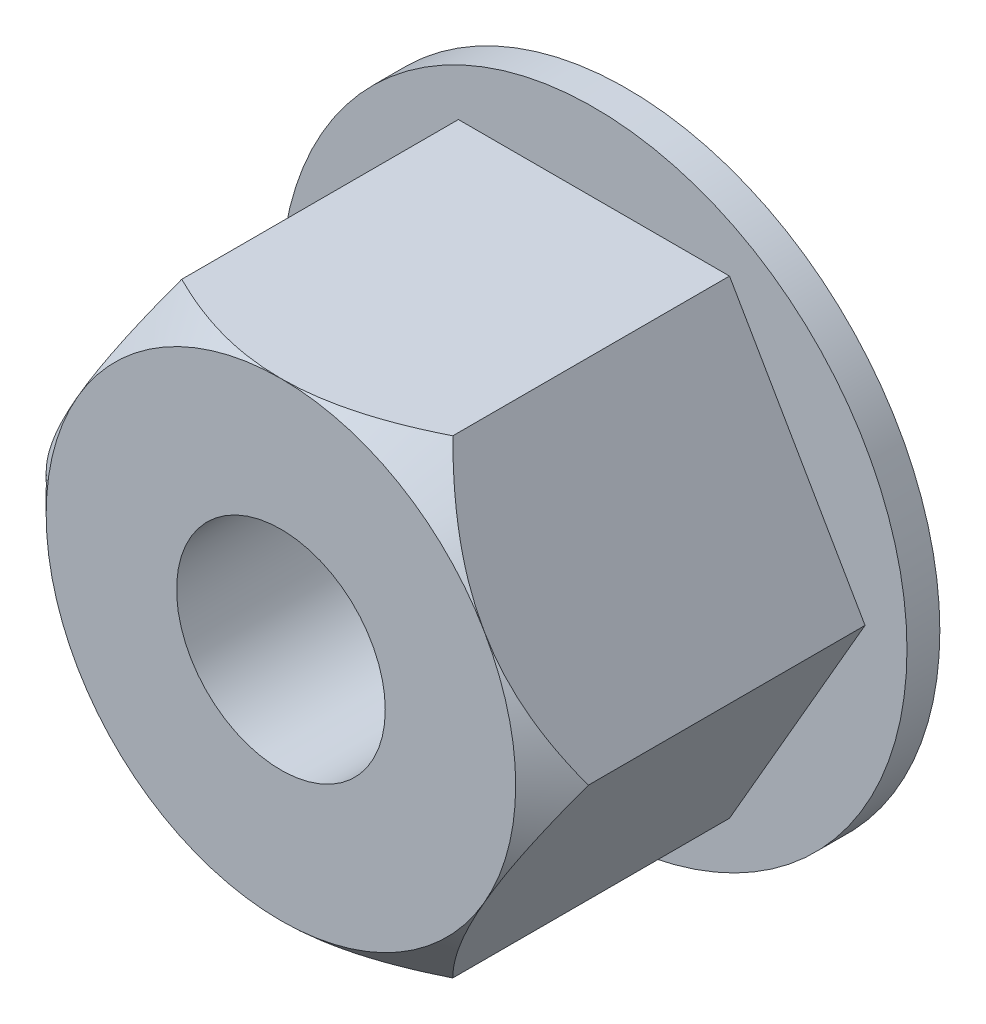
from build123d import *

# Parameters (mm, degrees)
SKETCH1_R           = 9.525
BOSS_EXTRUDE1_DEPTH = 1
BOSS_EXTRUDE2_DEPTH = 9.525
SKETCH3_R           = 3.175
CUT_EXTRUDE1_DEPTH  = 18.094644629
SKETCH4_OUTSIDE_W   = 45.884
SKETCH4_OUTSIDE_H   = 45.884
SKETCH4_OUTSIDE_R   = 7.14375
CUT_EXTRUDE2_DEPTH  = 9.525
CUT_EXTRUDE2_DRAFT  = -45


with BuildPart() as part:
    # Sketch1 → Boss-Extrude1 (new body)
    with BuildSketch(Plane.XY):
        Circle(SKETCH1_R)
    extrude(amount=BOSS_EXTRUDE1_DEPTH)

    # Sketch2 → Boss-Extrude2 (add)
    with BuildSketch(Plane.XY.offset(1)):
        Polygon((4.124445986, -7.14375), (8.248891971, 0), (4.124445986, 7.14375), (-4.124445986, 7.14375), (-8.248891971, 0), (-4.124445986, -7.14375), align=None)
    extrude(amount=BOSS_EXTRUDE2_DEPTH)

    # Sketch3 → Cut-Extrude1 (cut, through all)
    with BuildSketch(Plane.XY.offset(10.525)):
        Circle(SKETCH3_R)
    extrude(amount=-CUT_EXTRUDE1_DEPTH, mode=Mode.SUBTRACT)


with BuildPart() as cut_extrude2_tool:
    # Sketch4 outside → Cut-Extrude2 (with draft: the straight prism first)
    with BuildSketch(Plane.XY.offset(10.525)):
        Rectangle(SKETCH4_OUTSIDE_W, SKETCH4_OUTSIDE_H)
        Circle(SKETCH4_OUTSIDE_R, mode=Mode.SUBTRACT)
    extrude(amount=-CUT_EXTRUDE2_DEPTH)
    # Cut-Extrude2: the draft: its side faces are tilted about the plane it starts from
    cut_extrude2_sides = [cut_extrude2_tool.faces().sort_by_distance(p)[0] for p in [
        (0, -22.942, 5.7625),
        (22.942, 0, 5.7625),
        (0, 22.942, 5.7625),
        (-22.942, 0, 5.7625),
        (-7.14375, 0, 5.7625),
    ]]
    draft(cut_extrude2_sides, Plane.XY.offset(10.525), CUT_EXTRUDE2_DRAFT)


with BuildPart() as part_1:
    add(part.part)

    # Cut-Extrude2: cut by cut_extrude2_tool
    add(cut_extrude2_tool.part, mode=Mode.SUBTRACT)


solid = part_1.part
